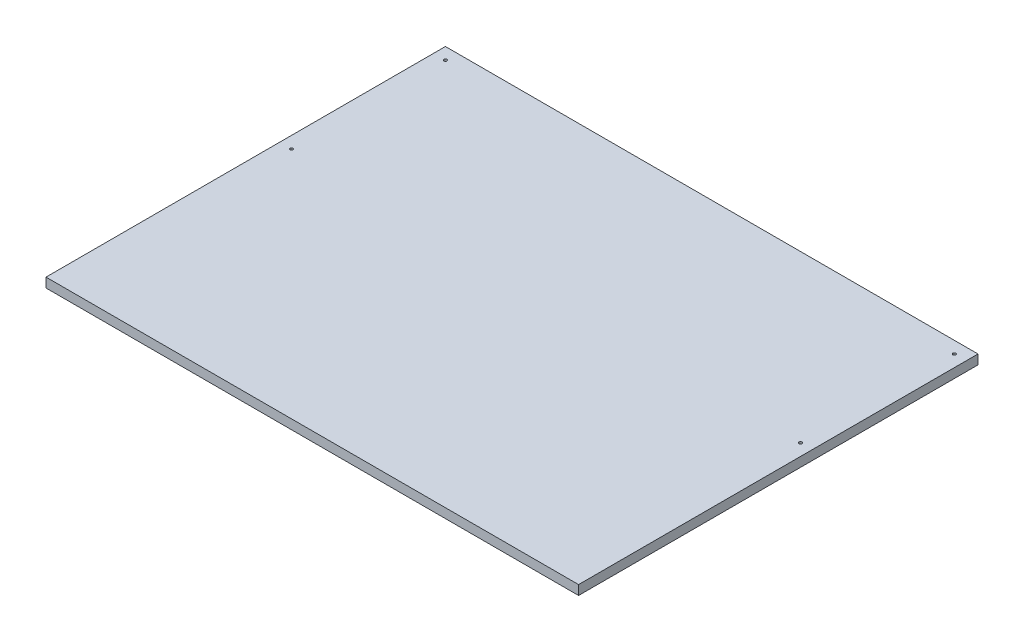
from build123d import *

# Parameters (mm, degrees)
SKETCH_1_W      = 900
SKETCH_1_H      = 675
SKETCH_1_R      = 2.5
EXTRUDE_1_DEPTH = 16


with BuildPart() as part:
    # Эскиз1 → Бобышка-Вытянуть1 (new body)
    with BuildSketch(Plane(origin=(0, 0, 0), x_dir=(1, 0, 0), z_dir=(0, 1, 0))):
        Rectangle(SKETCH_1_W, SKETCH_1_H)
        with Locations(Location((-430, 317.5, 0), (0, 0, 270))):
            Circle(SKETCH_1_R, mode=Mode.SUBTRACT)
        with Locations(Location((430, 317.5, 0), (0, 0, 270))):
            Circle(SKETCH_1_R, mode=Mode.SUBTRACT)
        with Locations(Location((430, 57.5, 0), (0, 0, 270))):
            Circle(SKETCH_1_R, mode=Mode.SUBTRACT)
        with Locations(Location((-430, 57.5, 0), (0, 0, 270))):
            Circle(SKETCH_1_R, mode=Mode.SUBTRACT)
    extrude(amount=EXTRUDE_1_DEPTH)


solid = part.part
